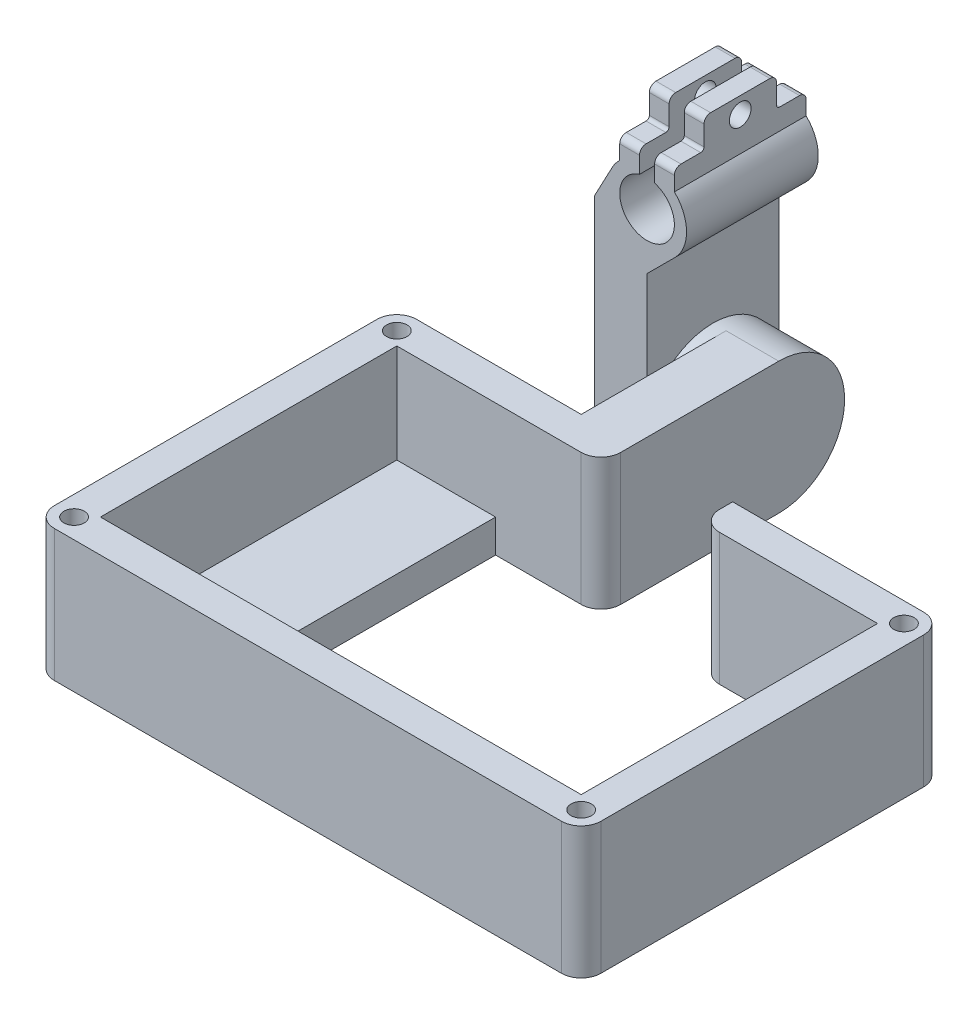
from build123d import *

# Parameters (mm, degrees)
EXTRUDE_1_DEPTH             = 10
EXTRUDE_2_REACH             = 34.619
SKETCH_2_R                  = 10
EXTRUDE_2_DIRECTION_2_DEPTH = 2
SKETCH_6_R                  = 1.65
SKETCH_6_W                  = 14.704506527
SKETCH_6_H                  = 8.520368268
CUT_EXTRUDE_2_DEPTH         = 43.983979574
FILLET_1_R                  = 1
FILLET_2_R                  = 0.5
EXTRUDE_3_DEPTH             = 8
EXTRUDE_4_DEPTH             = 55
SKETCH_9_W                  = 73
SKETCH_9_H                  = 45
CUT_EXTRUDE_3_DEPTH         = 13
SKETCH_10_W                 = 15
SKETCH_10_H                 = 20
CUT_EXTRUDE_4_DEPTH         = 13
SKETCH_11_W                 = 73
SKETCH_11_H                 = 45
CUT_EXTRUDE_6_DEPTH         = 13
SKETCH_12_W                 = 15
SKETCH_12_H                 = 45
SKETCH_12_W_2               = 10
EXTRUDE_5_DEPTH             = 5
FILLET_3_R                  = 3
SKETCH_14_R                 = 1.55
CUT_EXTRUDE_7_DEPTH         = 102.004950374


with BuildPart() as part:
    # 草图1 → 凸台-拉伸1 (new, symmetric)
    with BuildSketch(Plane.XY):
        with BuildLine():
            Line((-1.15, 3.987480407), (-1.15, 12))
            Line((-1.15, 12), (-4.15, 12))
            Line((-4.15, 12), (-4.15, 4.333301282))
            ThreePointArc((-4.15, 4.333301282), (-4.784308974, 3.620826928), (-5.297685557, 2.816829377))
            Line((-5.297685557, 2.816829377), (-8, -2.265484914))
            Line((-8, -2.265484914), (-8, -30))
            Line((-8, -30), (0, -30))
            Line((0, -30), (0, -8.485281374))
            Line((0, -8.485281374), (4.242640687, -4.242640687))
            ThreePointArc((4.242640687, -4.242640687), (5.999649956, 0.064810571), (4.15, 4.333301282))
            Line((4.15, 4.333301282), (4.15, 12))
            Line((4.15, 12), (1.15, 12))
            Line((1.15, 12), (1.15, 3.987480407))
            ThreePointArc((1.15, 3.987480407), (0, -4.15), (-1.15, 3.987480407))
        make_face()
    extrude(amount=EXTRUDE_1_DEPTH, both=True)

    # 凸台-拉伸2: up to this face of the body (flat: up to its plane)
    extrude_2_end = Plane(part.part.faces().sort_by_distance((-8, -16.132742457, 0))[0])
    # 草图2 → 凸台-拉伸2 (add, up to the picked face)
    with BuildSketch(Plane(origin=(0, 0, 0), x_dir=(0, 0, -1), z_dir=(1, 0, 0)), mode=Mode.PRIVATE) as extrude_2_sk1:
        with Locations((0, -30)):
            Circle(SKETCH_2_R)
    extrude_2_tool1 = split(extrude(extrude_2_sk1.sketch, amount=-EXTRUDE_2_REACH, mode=Mode.PRIVATE), bisect_by=extrude_2_end, keep=Keep.BOTH, mode=Mode.PRIVATE)
    add(extrude_2_tool1.solids().sort_by(Axis((0, -30, 0), (-1, 0, 0)))[0])

    # 草图2 → 凸台-拉伸2 direction 2 (add)
    with BuildSketch(Plane(origin=(0, 0, 0), x_dir=(0, 0, -1), z_dir=(1, 0, 0))):
        with Locations((0, -30)):
            Circle(SKETCH_2_R)
    extrude(amount=EXTRUDE_2_DIRECTION_2_DEPTH)

    # 草图6 → 切除-拉伸2 (cut, through all)
    with BuildSketch(Plane(origin=(4.15, 0, 0), x_dir=(0, 0, -1), z_dir=(1, 0, 0))):
        with Locations(Location((0, 9.5, 0), (0, 0, 90))):
            Circle(SKETCH_6_R)
        with Locations((-12.852253263, 11.760184134)):
            Rectangle(SKETCH_6_W, SKETCH_6_H)
        with Locations((12.852253263, 11.760184134)):
            Rectangle(SKETCH_6_W, SKETCH_6_H)
    extrude(amount=-CUT_EXTRUDE_2_DEPTH, mode=Mode.SUBTRACT)

    # 圆角1
    fillet_1_edges = [part.edges().sort_by_distance(p)[0] for p in [
        (2.65, 7.5, -10),
        (-2.65, 7.5, -10),
        (2.65, 7.5, 10),
        (-2.65, 7.5, 10),
        (2.65, 12, 5.5),
        (-2.65, 12, 5.5),
        (2.65, 12, -5.5),
        (-2.65, 12, -5.5),
    ]]
    fillet(fillet_1_edges, radius=FILLET_1_R)

    # 圆角2
    fillet_2_edges = [part.edges().sort_by_distance(p)[0] for p in [
        (-2.65, 7.5, 5.5),
        (2.65, 7.5, 5.5),
        (2.65, 7.5, -5.5),
        (-2.65, 7.5, -5.5),
    ]]
    fillet(fillet_2_edges, radius=FILLET_2_R)

    # 草图7 → 凸台-拉伸3 (add)
    with BuildSketch(Plane(origin=(2, 0, 0), x_dir=(0, 0, -1), z_dir=(1, 0, 0))):
        with BuildLine():
            Line((0, -20), (-22, -20))
            Line((-22, -20), (-22, -40))
            Line((-22, -40), (0, -40))
            ThreePointArc((0, -40), (10, -30), (0, -20))
        make_face()
    extrude(amount=EXTRUDE_3_DEPTH)

    # 草图8 → 凸台-拉伸4 (add)
    with BuildSketch(Plane.XY.offset(22)):
        Polygon((10, -20), (-26, -20), (-26, -40), (2, -40), (57, -40), (57, -20), align=None)
    extrude(amount=EXTRUDE_4_DEPTH)

    # 草图9 → 切除-拉伸3 (cut)
    with BuildSketch(Plane(origin=(0, -20, 0), x_dir=(1, 0, 0), z_dir=(0, 1, 0))):
        with Locations((15.5, -49.5)):
            Rectangle(SKETCH_9_W, SKETCH_9_H)
    extrude(amount=-CUT_EXTRUDE_3_DEPTH, mode=Mode.SUBTRACT)

    # 草图10 → 切除-拉伸4 (cut)
    with BuildSketch(Plane(origin=(0, 0, 22), x_dir=(-1, 0, 0), z_dir=(0, 0, -1))):
        with Locations((-17.5, -30)):
            Rectangle(SKETCH_10_W, SKETCH_10_H)
    extrude(amount=-CUT_EXTRUDE_4_DEPTH, mode=Mode.SUBTRACT)

    # 草图11 → 切除-拉伸6 (cut)
    with BuildSketch(Plane(origin=(0, -33, 0), x_dir=(1, 0, 0), z_dir=(0, 1, 0))):
        with Locations((15.5, -49.5)):
            Rectangle(SKETCH_11_W, SKETCH_11_H)
    extrude(amount=-CUT_EXTRUDE_6_DEPTH, mode=Mode.SUBTRACT)

    # 草图12 → 凸台-拉伸5 (add)
    with BuildSketch(Plane.XZ.offset(40)):
        with Locations((-13.5, 49.5)):
            Rectangle(SKETCH_12_W, SKETCH_12_H)
        with Locations((47, 49.5)):
            Rectangle(SKETCH_12_W_2, SKETCH_12_H)
    extrude(amount=-EXTRUDE_5_DEPTH)

    # 圆角3
    fillet_3_edges = [part.edges().sort_by_distance(p)[0] for p in [
        (-26, -30, 22),
        (57, -30, 22),
        (-26, -30, 77),
        (57, -30, 77),
        (10, -30, 27),
        (25, -30, 27),
    ]]
    fillet(fillet_3_edges, radius=FILLET_3_R)

    # 草图14 → 切除-拉伸7 (cut, through all)
    with BuildSketch(Plane(origin=(0, -20, 0), x_dir=(1, 0, 0), z_dir=(0, 1, 0))):
        with Locations(Location((-23, -25, 0), (0, 0, 270))):
            Circle(SKETCH_14_R)
        with Locations(Location((54, -25, 0), (0, 0, 270))):
            Circle(SKETCH_14_R)
        with Locations(Location((-23, -74, 0), (0, 0, 270))):
            Circle(SKETCH_14_R)
        with Locations(Location((54, -74, 0), (0, 0, 270))):
            Circle(SKETCH_14_R)
    extrude(amount=-CUT_EXTRUDE_7_DEPTH, mode=Mode.SUBTRACT)


solid = part.part
